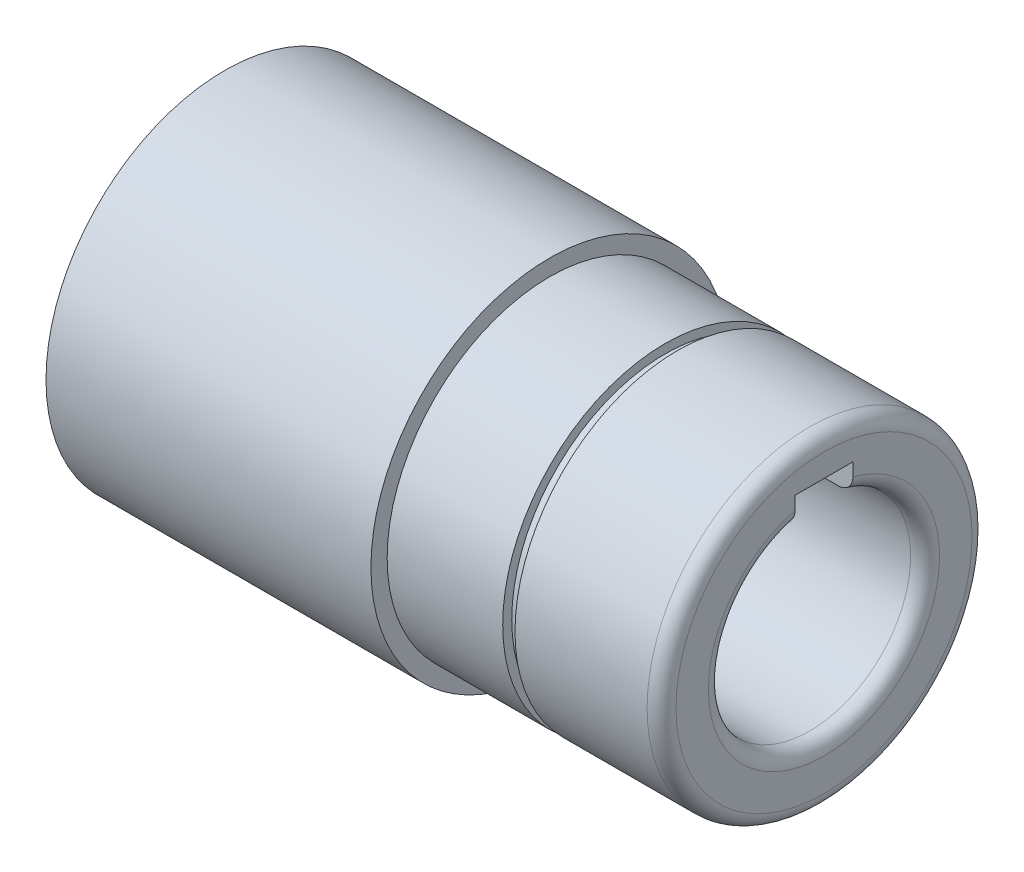
from build123d import *

# Parameters (mm, degrees)
CUT_EXTRUDE_1_REACH = 93.462
SKETCH_2_W          = 5
SKETCH_2_H          = 4.6
CUT_EXTRUDE_2_REACH = 93.462


with BuildPart() as part:
    # 草图1 → 旋转1 (revolve)
    with BuildSketch(Plane(origin=(0, 0, 0), x_dir=(1, 0, 0), z_dir=(0, 1, 0)), mode=Mode.PRIVATE) as revolve_1_sk:
        with BuildLine():
            Line((0, 10), (0, 14))
            Line((0, 14), (1.5, 14))
            Line((1.5, 14), (1.5, 24.75))
            Line((1.5, 24.75), (46.5, 24.75))
            Line((46.5, 24.75), (46.5, 22.5))
            Line((46.5, 22.5), (62.5, 22.5))
            Line((62.5, 22.5), (62.5, 21.25))
            Line((62.5, 21.25), (64.2, 21.25))
            Line((64.2, 21.25), (64.2, 22.5))
            Line((64.2, 22.5), (82.5, 22.5))
            ThreePointArc((82.5, 22.5), (83.914213562, 21.914213562), (84.5, 20.5))
            Line((84.5, 20.5), (84.5, 16))
            ThreePointArc((84.5, 16), (83.914213562, 14.585786438), (82.5, 14))
            Line((82.5, 14), (56.5, 14))
            Line((56.5, 14), (56.5, 14.25))
            Line((56.5, 14.25), (34.5, 14.25))
            Line((34.5, 14.25), (34.5, 18))
            Line((34.5, 18), (22.5, 18))
            Line((22.5, 18), (22.5, 10))
            Line((22.5, 10), (0, 10))
        make_face()
    revolve(revolve_1_sk.sketch.rotate(Axis((-32.624113475, 0, 0), (1, 0, 0)), 180), axis=Axis((-32.624113475, 0, 0), (1, 0, 0)))

    # 草图2 → 切除-拉伸1 (cut, up to next)
    with BuildSketch(Plane.ZY, mode=Mode.PRIVATE) as cut_extrude_1_sk1:
        with Locations((0, 10)):
            Rectangle(SKETCH_2_W, SKETCH_2_H)
    cut_extrude_1_tool1 = extrude(cut_extrude_1_sk1.sketch, amount=-CUT_EXTRUDE_1_REACH, mode=Mode.PRIVATE) & part.part
    add(cut_extrude_1_tool1.solids().sort_by_distance((0, 10, 0))[0], mode=Mode.SUBTRACT)

    # 草图3 → 切除-拉伸2 (cut, up to next)
    with BuildSketch(Plane(origin=(84.5, 0, 0), x_dir=(0, 0, -1), z_dir=(1, 0, 0)), mode=Mode.PRIVATE) as cut_extrude_2_sk1:
        Polygon((4, 14.7), (4, 10.868150386), (-4, 10.868150386), (-4, 14.7), (-4, 17.3), (4, 17.3), align=None)
    cut_extrude_2_tool1 = extrude(cut_extrude_2_sk1.sketch, amount=-CUT_EXTRUDE_2_REACH, mode=Mode.PRIVATE) & part.part
    add(cut_extrude_2_tool1.solids().sort_by_distance((84.5, 14.084075, 0))[0], mode=Mode.SUBTRACT)


solid = part.part
